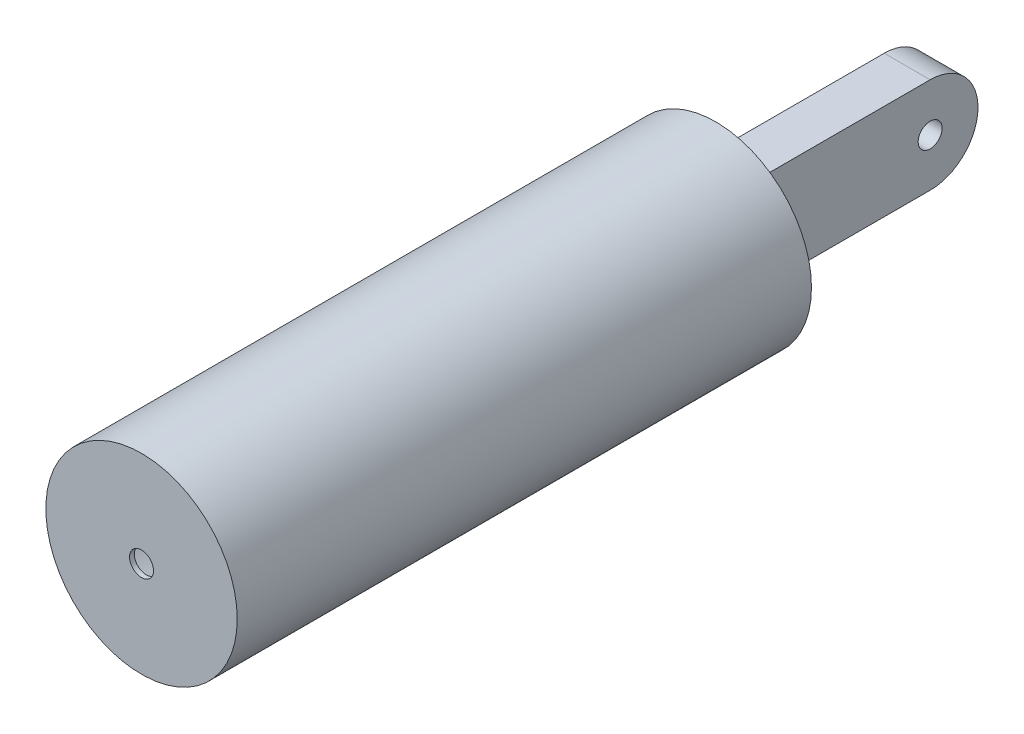
from build123d import *

# Parameters (mm, degrees)
SKETCH1_R           = 10
BOSS_EXTRUDE1_DEPTH = 30
SKETCH3_R           = 9.75
CUT_EXTRUDE1_DEPTH  = 29.5
SKETCH4_R           = 1.25
CUT_EXTRUDE2_DEPTH  = 1
BOSS_EXTRUDE2_DEPTH = 2.4
SKETCH6_R           = 1.25
CUT_EXTRUDE3_DEPTH  = 10


with BuildPart() as part:
    # Sketch1 → Boss-Extrude1 (new, symmetric)
    with BuildSketch(Plane.XY):
        Circle(SKETCH1_R)
    extrude(amount=BOSS_EXTRUDE1_DEPTH, both=True)

    # Sketch3 → Cut-Extrude1 (cut, symmetric)
    with BuildSketch(Plane.XY):
        Circle(SKETCH3_R)
    extrude(amount=CUT_EXTRUDE1_DEPTH, both=True, mode=Mode.SUBTRACT)

    # Sketch4 → Cut-Extrude2 (cut)
    with BuildSketch(Plane.XY.offset(30)):
        Circle(SKETCH4_R)
    extrude(amount=-CUT_EXTRUDE2_DEPTH, mode=Mode.SUBTRACT)

    # Sketch5 → Boss-Extrude2 (add, symmetric)
    with BuildSketch(Plane(origin=(0, 0, 0), x_dir=(0, 0, -1), z_dir=(1, 0, 0))):
        with BuildLine():
            Line((30, 5), (30, -5))
            Line((30, -5), (50, -5))
            ThreePointArc((50, -5), (55, 0), (50, 5))
            Line((50, 5), (30, 5))
        make_face()
    extrude(amount=BOSS_EXTRUDE2_DEPTH, both=True)

    # Sketch6 → Cut-Extrude3 (cut)
    with BuildSketch(Plane(origin=(2.4, 0, 0), x_dir=(0, 0, -1), z_dir=(1, 0, 0))):
        with Locations((50, 0)):
            Circle(SKETCH6_R)
    extrude(amount=-CUT_EXTRUDE3_DEPTH, mode=Mode.SUBTRACT)


solid = part.part
